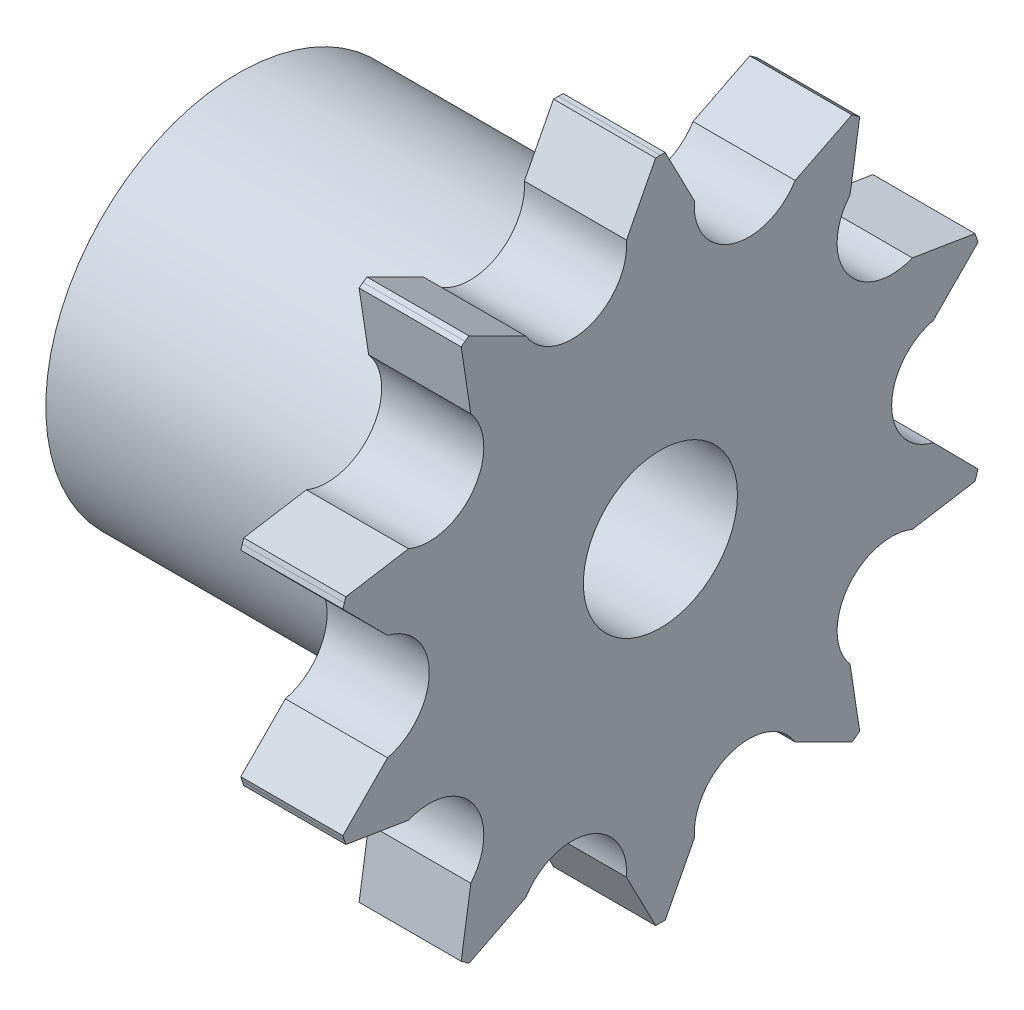
from build123d import *

# Parameters (mm, degrees)
BOSS_EXTRUDE1_DEPTH = 5.3
CIRPATTERN2_COUNT   = 10
SKETCH2_R           = 10
SKETCH2_R_2         = 4
BOSS_EXTRUDE2_DEPTH = 16.6
CUT_EXTRUDE2_START  = -16.6
SKETCH2_2_R         = 4
CUT_EXTRUDE2_DEPTH  = 16.6


with BuildPart() as part:
    # Sketch1 → Boss-Extrude1 (new body)
    with BuildSketch(Plane(origin=(0, 0, 0), x_dir=(0, 0, -1), z_dir=(1, 0, 0))):
        with BuildLine():
            Line((0, 0), (10.139295602, 13.955543153))
            Line((10.139295602, 13.955543153), (9.935981835, 14.101019997))
            Line((9.935981835, 14.101019997), (6.992185789, 12.620548152))
            ThreePointArc((6.992185789, 12.620548152), (3.708203932, 11.412678196), (1.761374949, 14.320141621))
            Line((1.761374949, 14.320141621), (0.249993436, 17.248188406))
            ThreePointArc((0.249993436, 17.248188406), (0.125, 17.249547096), (0, 17.25))
            Line((0, 17.25), (0, 0))
        make_face()
    boss_extrude1 = extrude(amount=BOSS_EXTRUDE1_DEPTH)

    # CirPattern2: Boss-Extrude1 ×10 about axis
    cirpattern2_axis = Axis((5.3, 0, 0), (-1, 0, 0))
    for i in range(1, CIRPATTERN2_COUNT):
        add(boss_extrude1.rotate(cirpattern2_axis, i * 360 / CIRPATTERN2_COUNT))

    # Sketch2 → Boss-Extrude2 (add)
    with BuildSketch(Plane.ZY):
        Circle(SKETCH2_R)
        Circle(SKETCH2_R_2, mode=Mode.SUBTRACT)
    extrude(amount=BOSS_EXTRUDE2_DEPTH)

    # Sketch2<2> → Cut-Extrude2 (cut)
    with BuildSketch(Plane.ZY.offset(CUT_EXTRUDE2_START)):
        Circle(SKETCH2_2_R)
    extrude(amount=CUT_EXTRUDE2_DEPTH, mode=Mode.SUBTRACT)


solid = part.part
